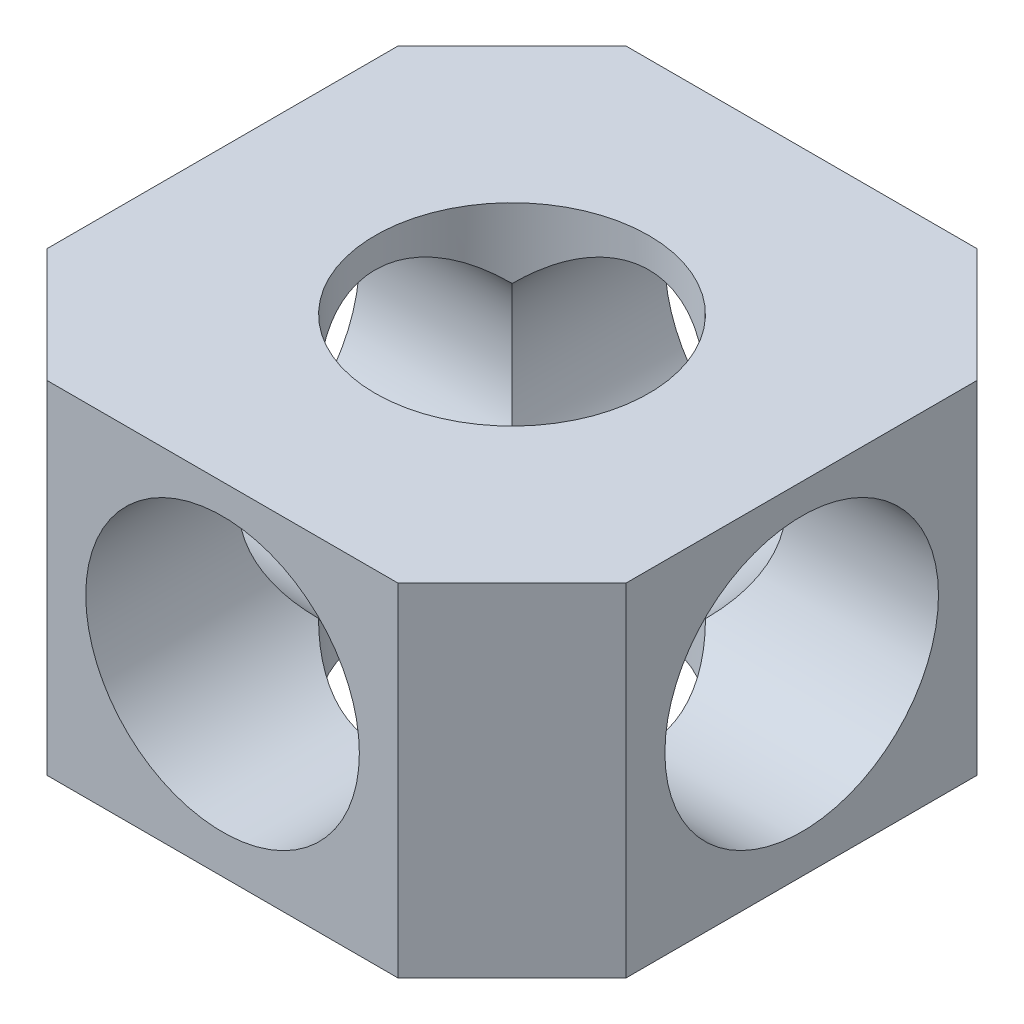
from build123d import *

# Parameters (mm, degrees)
SKETCH1_W           = 8.466666666
SKETCH1_H           = 8.466666667
BOSS_EXTRUDE1_DEPTH = 5
CHAMFER1_SIZE       = 1.666666667
SKETCH2_R           = 2
CUT_EXTRUDE1_DEPTH  = 10
SKETCH3_R           = 2
CUT_EXTRUDE2_DEPTH  = 12.317961286
SKETCH4_R           = 2
CUT_EXTRUDE3_DEPTH  = 10


with BuildPart() as part:
    # Sketch1 → Boss-Extrude1 (new body)
    with BuildSketch(Plane(origin=(0, 0, 0), x_dir=(1, 0, 0), z_dir=(0, 1, 0))):
        with Locations((-1.371290047, 0.771071428)):
            Rectangle(SKETCH1_W, SKETCH1_H)
    extrude(amount=BOSS_EXTRUDE1_DEPTH)

    # Chamfer1
    chamfer1_edges = [part.edges().sort_by_distance(p)[0] for p in [
        (2.862043286, 2.5, 3.462261905),
        (-5.60462338, 2.5, 3.462261905),
        (-5.60462338, 2.5, -5.004404762),
        (2.862043286, 2.5, -5.004404762),
    ]]
    chamfer(chamfer1_edges, length=CHAMFER1_SIZE)

    # Sketch2 → Cut-Extrude1 (cut)
    with BuildSketch(Plane(origin=(2.862043286, 0, 0), x_dir=(0, 0, -1), z_dir=(1, 0, 0))):
        with Locations((0.772738095, 2.565)):
            Circle(SKETCH2_R)
    extrude(amount=-CUT_EXTRUDE1_DEPTH, mode=Mode.SUBTRACT)

    # Sketch3 → Cut-Extrude2 (cut, through all)
    with BuildSketch(Plane.XY.offset(3.462261905)):
        with Locations((-1.36962338, 2.565)):
            Circle(SKETCH3_R)
    extrude(amount=-CUT_EXTRUDE2_DEPTH, mode=Mode.SUBTRACT)

    # Sketch4 → Cut-Extrude3 (cut)
    with BuildSketch(Plane(origin=(0, 5, 0), x_dir=(1, 0, 0), z_dir=(0, 1, 0))):
        with Locations(Location((-1.372956714, 0.772738095, 0), (0, 0, 270))):
            Circle(SKETCH4_R)
    extrude(amount=-CUT_EXTRUDE3_DEPTH, mode=Mode.SUBTRACT)


solid = part.part
